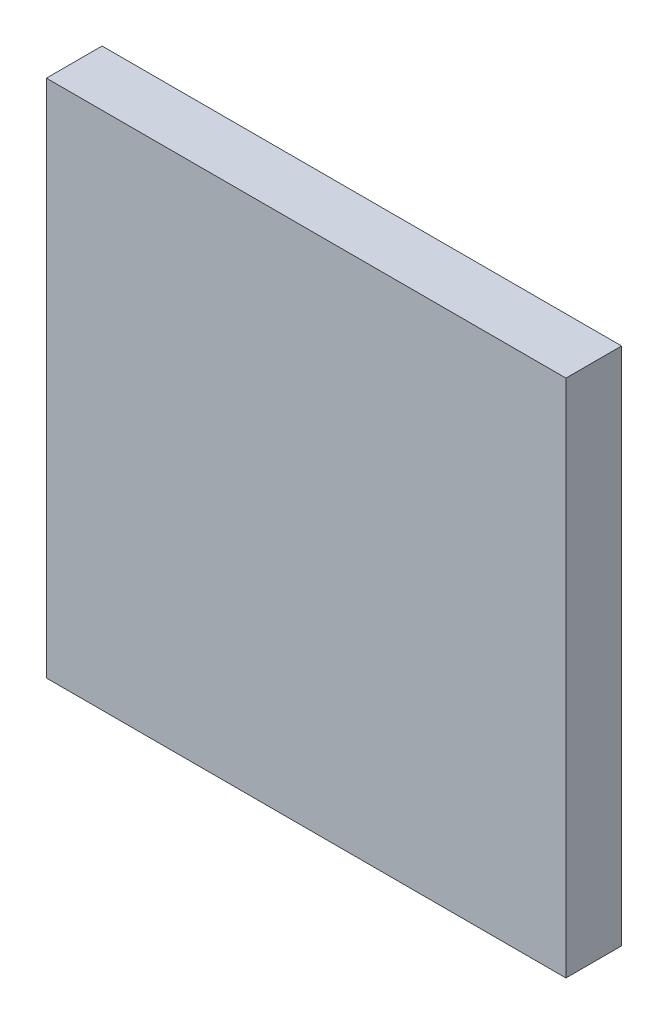
from build123d import *

# Parameters (mm, degrees)
SKETCH2_W           = 28
SKETCH2_H           = 28
BOSS_EXTRUDE1_DEPTH = 3


with BuildPart() as part:
    # Sketch2 → Boss-Extrude1 (new body)
    with BuildSketch(Plane.XY):
        Rectangle(SKETCH2_W, SKETCH2_H)
    extrude(amount=BOSS_EXTRUDE1_DEPTH)


solid = part.part
